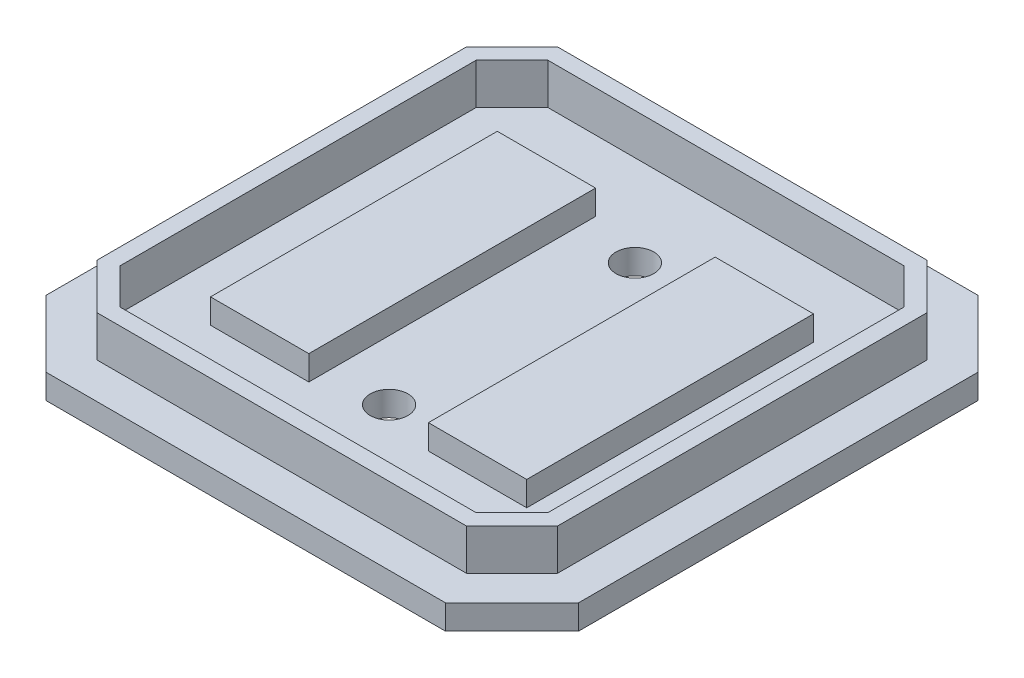
from build123d import *

# Parameters (mm, degrees)
SKETCH1_W      = 65
SKETCH1_H      = 65
EXTRUDE1_DEPTH = 3
CHAMFER1_SIZE  = 8.125
EXTRUDE2_DEPTH = 5
SKETCH3_W      = 12
SKETCH3_H      = 35
EXTRUDE3_DEPTH = 3
SKETCH4_R      = 2.3
EXTRUDE4_DEPTH = 3


with BuildPart() as part:
    # Sketch1 → Extrude1 (new body)
    with BuildSketch(Plane(origin=(0, 0, 0), x_dir=(1, 0, 0), z_dir=(0, 1, 0))):
        Rectangle(SKETCH1_W, SKETCH1_H)
    extrude(amount=EXTRUDE1_DEPTH)

    # Chamfer1
    chamfer1_edges = [part.edges().sort_by_distance(p)[0] for p in [
        (32.5, 1.5, 32.5),
        (-32.5, 1.5, 32.5),
        (-32.5, 1.5, -32.5),
        (32.5, 1.5, -32.5),
    ]]
    chamfer(chamfer1_edges, length=CHAMFER1_SIZE)

    # Sketch2 → Extrude2 (add)
    with BuildSketch(Plane(origin=(0, 3, 0), x_dir=(1, 0, 0), z_dir=(0, 1, 0))):
        Polygon((22.552460326, 28.1), (-22.552460326, 28.1), (-28.1, 22.552460326), (-28.1, -22.552460326), (-22.552460326, -28.1), (22.552460326, -28.1), (28.1, -22.552460326), (28.1, 22.552460326), align=None)
        Polygon((-21.724033201, 26.1), (-26.1, 21.724033201), (-26.1, -11.272604381), (-26.1, -21.724033201), (-21.724033201, -26.1), (21.724033201, -26.1), (26.1, -21.724033201), (26.1, 21.724033201), (21.724033201, 26.1), align=None, mode=Mode.SUBTRACT)
    extrude(amount=EXTRUDE2_DEPTH)

    # Sketch3 → Extrude3 (add)
    with BuildSketch(Plane(origin=(0, 3, 0), x_dir=(1, 0, 0), z_dir=(0, 1, 0))):
        with Locations((-13.296722284, 0)):
            Rectangle(SKETCH3_W, SKETCH3_H)
    extrude3 = extrude(amount=EXTRUDE3_DEPTH)

    # Mirror1: Extrude3 across plane
    add(extrude3.mirror(Plane(origin=(0, 0, 0), x_dir=(0, 0, 1), z_dir=(1, 0, 0))))

    # Sketch4 → Extrude4 (cut)
    with BuildSketch(Plane(origin=(0, 3, 0), x_dir=(1, 0, 0), z_dir=(0, 1, 0))):
        with Locations(Location((0, 15, 0), (0, 0, 270))):
            Circle(SKETCH4_R)
        with Locations(Location((0, -15, 0), (0, 0, 270))):
            Circle(SKETCH4_R)
    extrude(amount=-EXTRUDE4_DEPTH, mode=Mode.SUBTRACT)


solid = part.part
